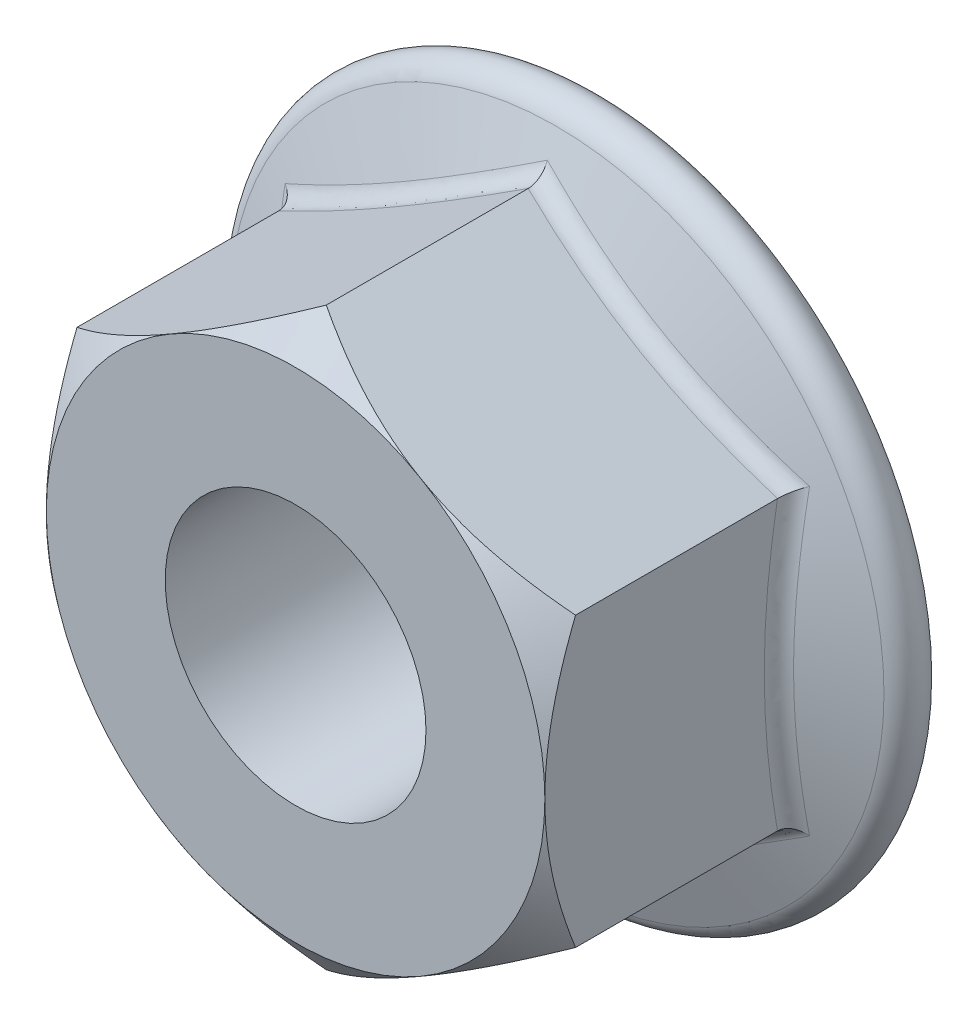
from build123d import *

# Parameters (mm, degrees)
BASENUTSKE_R   = 3.4
BASENUT_DEPTH  = 8
FLANGEFILLET_R = 0.48


with BuildPart() as part:
    # BaseNutSke → BaseNut (new body)
    with BuildSketch(Plane.XY):
        Polygon((6.5, 3.75277675), (6.5, -3.75277675), (0, -7.505553499), (-6.5, -3.75277675), (-6.5, 3.75277675), (0, 7.505553499), align=None)
        Circle(BASENUTSKE_R, mode=Mode.SUBTRACT)
    extrude(amount=-BASENUT_DEPTH)

    # Sketch6 → Flange (revolve)
    with BuildSketch(Plane(origin=(0, 0, 0), x_dir=(0, 0, -1), z_dir=(1, 0, 0)), mode=Mode.PRIVATE) as flange_sk:
        with BuildLine():
            Line((4.928123777, 3.4), (6.8, 8.542937654))
            ThreePointArc((6.8, 8.542937654), (7.488773543, 8.940601245), (8, 8.331345278))
            Line((8, 8.331345278), (8, 3.4))
            Line((8, 3.4), (4.928123777, 3.4))
        make_face()
    revolve(flange_sk.sketch.rotate(Axis((0, 0, 0), (0, 0, -1)), 90), axis=Axis((0, 0, 0), (0, 0, -1)))

    # Sketch3 → Double-Chamfer (revolve, cut)
    with BuildSketch(Plane(origin=(0, 0, 0), x_dir=(0, 0, -1), z_dir=(1, 0, 0)), mode=Mode.PRIVATE) as double_chamfer_sk:
        Polygon((0.8, 20.205553499), (-12.7, 20.205553499), (-12.7, 6.5), (0, 6.5), (0.8, 7.505553499), align=None)
    revolve(double_chamfer_sk.sketch.rotate(Axis((0, 0, 0), (0, 0, -1)), 90), axis=Axis((0, 0, 0), (0, 0, -1)), mode=Mode.SUBTRACT)

    # FlangeFillet
    flangefillet_edges = [part.edges().sort_by_distance(p)[0] for p in [
        (6.5, -1.884573791, -6.153862438),
        (6.5, 1.884573791, -6.153862438),
        (3.25, -5.629165125, -6.056431503),
        (3.25, 5.629165125, -6.056431503),
        (-3.25, 5.629165125, -6.056431503),
        (-6.5, 0, -6.056431503),
        (-3.25, -5.629165125, -6.056431503),
    ]]
    fillet(flangefillet_edges, radius=FLANGEFILLET_R)


solid = part.part
